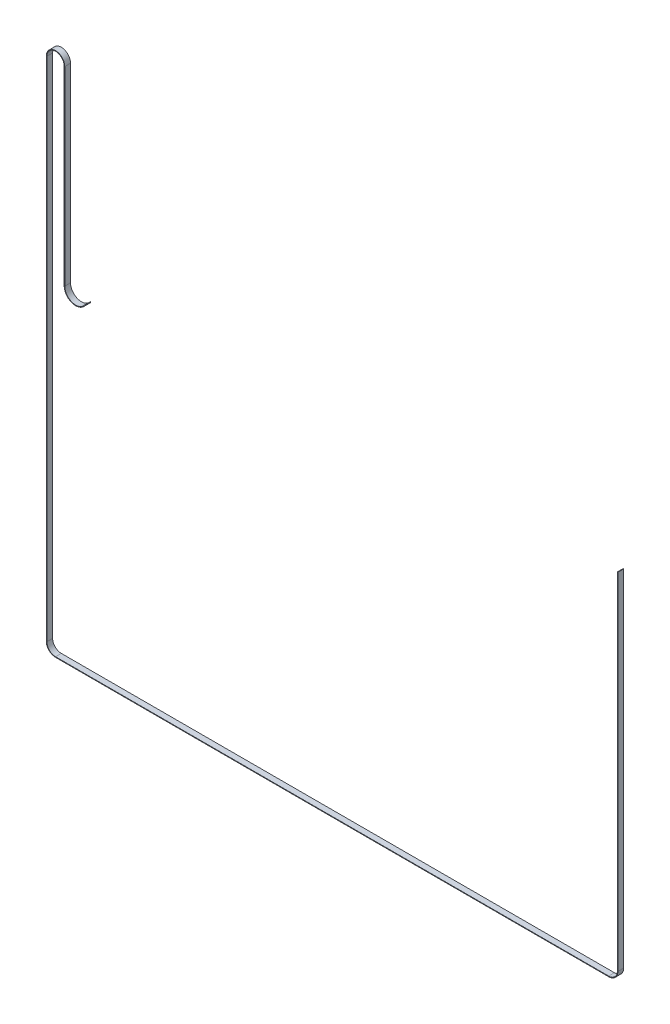
from build123d import *

# Parameters (mm, degrees)
LINEAR_AUSTRAGEN_D_NN1_DEPTH = 2.5


with BuildPart() as part:
    # Skizze1 → Linear-Austragen-Dünn1 (new, symmetric)
    with BuildSketch(Plane.XY):
        with BuildLine():
            Line((247.5, 300), (247.5, 0))
            ThreePointArc((247.5, 0), (245.303300859, -5.303300859), (240, -7.5))
            Line((240, -7.5), (-240, -7.5))
            ThreePointArc((-240, -7.5), (-245.303300859, -5.303300859), (-247.5, 0))
            Line((-247.5, 0), (-247.5, 440))
            ThreePointArc((-247.5, 440), (-240, 447.5), (-232.5, 440))
            Line((-232.5, 440), (-232.5, 275))
            ThreePointArc((-232.5, 275), (-225.612554872, 265.496737288), (-214.437599567, 269.084114669))
            Line((-214.437599567, 269.084114669), (-214.840719588, 269.379908935))
            ThreePointArc((-214.840719588, 269.379908935), (-225.456927129, 265.971900424), (-232, 275))
            Line((-232, 275), (-232, 440))
            ThreePointArc((-232, 440), (-240, 448), (-248, 440))
            Line((-248, 440), (-248, 0))
            ThreePointArc((-248, 0), (-245.656854249, -5.656854249), (-240, -8))
            Line((-240, -8), (240, -8))
            ThreePointArc((240, -8), (245.656854249, -5.656854249), (248, 0))
            Line((248, 0), (248, 300))
            Line((248, 300), (247.5, 300))
        make_face()
    extrude(amount=LINEAR_AUSTRAGEN_D_NN1_DEPTH, both=True)


solid = part.part
